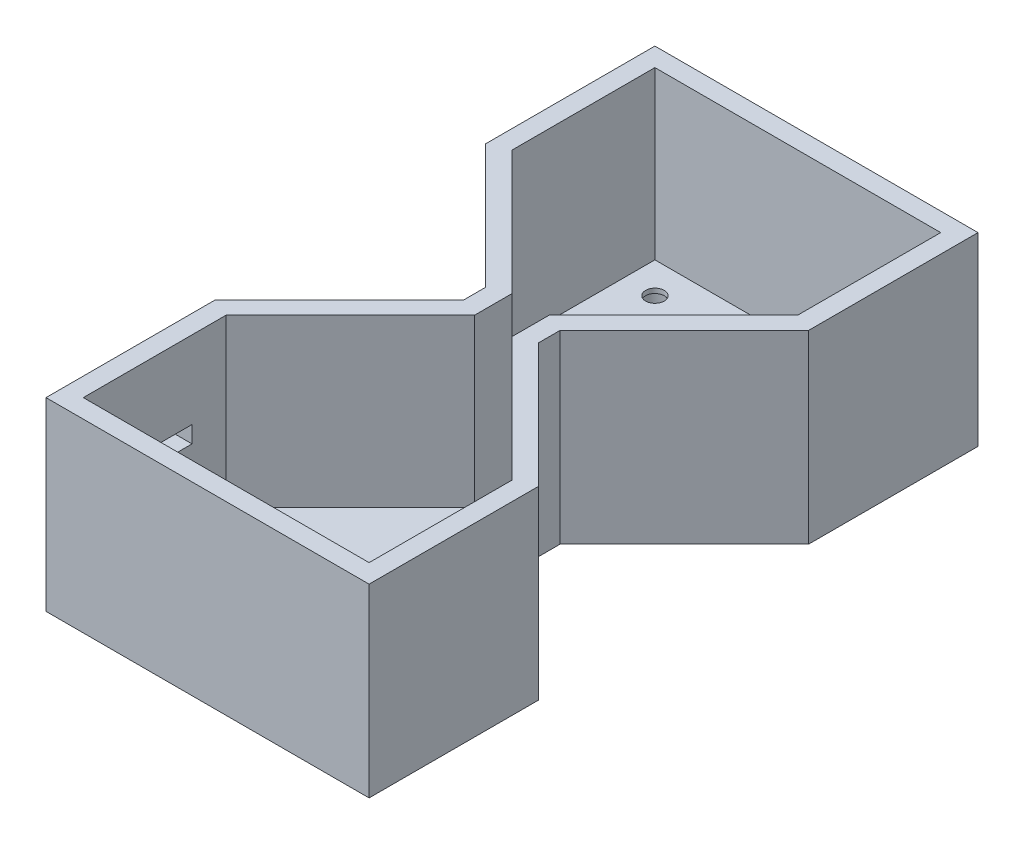
from build123d import *

# Parameters (mm, degrees)
EXTRUDE_2_DEPTH     = 26.8
SHELL_2_T           = 3
F_3_0MM_1_D         = 3
F_3_0MM_1_DEPTH     = 5
F_3_0MM_1_TIP       = 0.901290929
F_3_0MM_2_D         = 5.5
F_3_0MM_2_DEPTH     = 1.5
F_3_0MM_2_TIP       = 1.652366702
SKETCH_16_W         = 5
SKETCH_16_H         = 2.7
CUT_EXTRUDE_3_DEPTH = 10


with BuildPart() as part:
    # 草图2 → 凸台-拉伸2 (new body)
    with BuildSketch(Plane(origin=(0, 0, 0), x_dir=(1, 0, 0), z_dir=(0, 1, 0))):
        Polygon((0, 0), (46, 0), (46, 23), (26.000191801, 42.999808199), (26.000191801, 48.999808199), (46, 68.999616398), (46, 91.999616398), (0, 91.999616398), (0, 68.999616398), (19.999808199, 48.999808199), (19.999808199, 42.999808199), (0, 23), align=None)
    extrude(amount=EXTRUDE_2_DEPTH)

    # 抽壳2
    shell_2_openings = [part.faces().sort_by_distance(p)[0] for p in [
        (23, 26.8, -45.999808199),
    ]]
    offset(amount=SHELL_2_T, openings=shell_2_openings, kind=Kind.INTERSECTION)

    # Ø3.0mm 暗销孔1
    with Locations(Plane(origin=(5, -3, -5), x_dir=(0, 0, -1), z_dir=(0, -1, 0))):
        with Locations((0, 0), (0, 36), (82, 36), (82, 0)):
            Hole(F_3_0MM_1_D / 2, depth=F_3_0MM_1_DEPTH)
            with Locations((0, 0, -(F_3_0MM_1_DEPTH + F_3_0MM_1_TIP / 2))):  # 118° drill point
                Cone(0, F_3_0MM_1_D / 2, F_3_0MM_1_TIP, mode=Mode.SUBTRACT)

    # Ø3.0mm 暗销孔2
    with Locations(Plane(origin=(5, -3, -5), x_dir=(0, 0, -1), z_dir=(0, -1, 0))):
        with Locations((0, 0), (0, 36), (82, 36), (82, 0)):
            Hole(F_3_0MM_2_D / 2, depth=F_3_0MM_2_DEPTH)
            with Locations((0, 0, -(F_3_0MM_2_DEPTH + F_3_0MM_2_TIP / 2))):  # 118° drill point
                Cone(0, F_3_0MM_2_D / 2, F_3_0MM_2_TIP, mode=Mode.SUBTRACT)

    # 草图16 → 切除-拉伸3 (cut)
    with BuildSketch(Plane(origin=(0, 0, 0), x_dir=(0, 0, -1), z_dir=(1, 0, 0))):
        with Locations((15, 12.95)):
            Rectangle(SKETCH_16_W, SKETCH_16_H)
    extrude(amount=-CUT_EXTRUDE_3_DEPTH, mode=Mode.SUBTRACT)


solid = part.part
